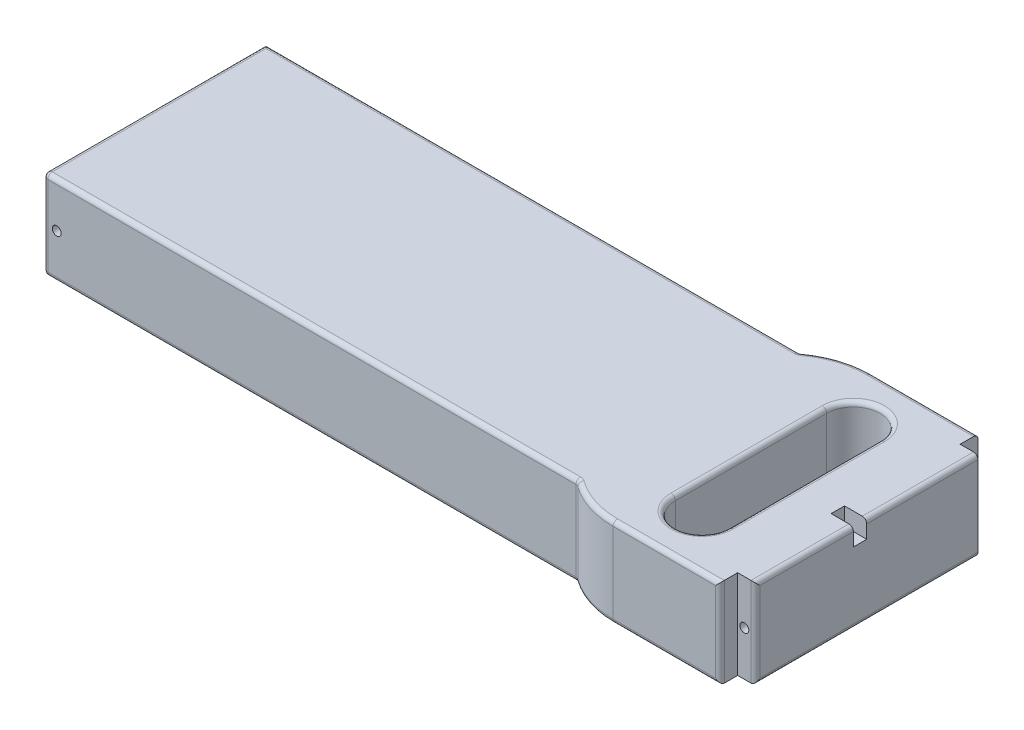
from build123d import *

# Parameters (mm, degrees)
SALIENTE_EXTRUIR1_DEPTH = 1
REDONDEO1_R             = 0.05
CORTAR_EXTRUIR1_DEPTH   = 1
REDONDEO2_R             = 0.05
CROQUIS3_R              = 0.05
CORTAR_EXTRUIR2_DEPTH   = 9.502352647
CORTAR_EXTRUIR3_DEPTH   = 0.2


with BuildPart() as part:
    # Croquis1 → Saliente-Extruir1 (new body)
    with BuildSketch(Plane(origin=(0, 0, 0), x_dir=(1, 0, 0), z_dir=(0, 1, 0))):
        with BuildLine():
            Line((0, 0), (0, 1.328125))
            Line((0, 1.328125), (6, 1.328125))
            ThreePointArc((6, 1.328125), (6.283772234, 1.476808298), (6.6, 1.528125))
            Line((6.6, 1.528125), (7.8, 1.528125))
            Line((7.8, 1.528125), (7.8, 1.328125))
            Line((7.8, 1.328125), (8, 1.328125))
            Line((8, 1.328125), (8, -1.171875))
            Line((8, -1.171875), (7.8, -1.171875))
            Line((7.8, -1.171875), (7.8, -1.371875))
            Line((7.8, -1.371875), (6.6, -1.371875))
            ThreePointArc((6.6, -1.371875), (6.283772234, -1.320558298), (6, -1.171875))
            Line((6, -1.171875), (0, -1.171875))
            Line((0, -1.171875), (0, 0))
        make_face()
    extrude(amount=SALIENTE_EXTRUIR1_DEPTH)

    # Redondeo1
    redondeo1_edges = [part.edges().sort_by_distance(p)[0] for p in [
        (8, 0, -0.078125),
        (6.283772234, 0, -1.476808298),
        (3, 0, -1.328125),
        (0, 0, -0.078125),
        (6.283772234, 0, 1.320558298),
        (0, 0.5, 1.171875),
        (6, 0.5, 1.171875),
        (3, 0, 1.171875),
        (3, 1, -1.328125),
        (6.283772234, 1, -1.476808298),
        (8, 1, -0.078125),
        (6.283772234, 1, 1.320558298),
        (3, 1, 1.171875),
        (0, 1, -0.078125),
        (7.2, 0, 1.371875),
        (7.2, 0, -1.528125),
        (7.2, 1, -1.528125),
        (7.2, 1, 1.371875),
        (7.8, 0.5, 1.371875),
        (8, 0.5, 1.171875),
        (6, 0.5, -1.328125),
    ]]
    fillet(redondeo1_edges, radius=REDONDEO1_R)

    # Croquis2 → Cortar-Extruir1 (cut)
    with BuildSketch(Plane(origin=(0, 1, 0), x_dir=(1, 0, 0), z_dir=(0, 1, 0))):
        with BuildLine():
            Line((7.3, -0.771875), (7.3, 0.928125))
            ThreePointArc((7.3, 0.928125), (7, 1.228125), (6.7, 0.928125))
            Line((6.7, 0.928125), (6.7, -0.771875))
            ThreePointArc((6.7, -0.771875), (7, -1.071875), (7.3, -0.771875))
        make_face()
    extrude(amount=-CORTAR_EXTRUIR1_DEPTH, mode=Mode.SUBTRACT)

    # Redondeo2
    redondeo2_edges = [part.edges().sort_by_distance(p)[0] for p in [
        (7, 0, -1.228125),
        (7.3, 0, -0.078125),
        (7, 0, 1.071875),
        (6.7, 0, -0.078125),
        (7, 1, -1.228125),
        (6.7, 1, -0.078125),
        (7, 1, 1.071875),
        (7.3, 1, -0.078125),
    ]]
    fillet(redondeo2_edges, radius=REDONDEO2_R)

    # Croquis3 → Cortar-Extruir2 (cut, through all)
    with BuildSketch(Plane.XY.offset(1.171875)):
        with Locations((7.875, 0.500489471)):
            Circle(CROQUIS3_R)
        with Locations((0.15, 0.500489471)):
            Circle(CROQUIS3_R)
    extrude(amount=-CORTAR_EXTRUIR2_DEPTH, mode=Mode.SUBTRACT)

    # Croquis4 → Cortar-Extruir3 (cut)
    with BuildSketch(Plane(origin=(0, 1, 0), x_dir=(1, 0, 0), z_dir=(0, 1, 0))):
        Polygon((7.95, -0.071875), (7.75, -0.071875), (7.75, 0.078125), (7.95, 0.078125), (8.181877464, 0.078125), (8.181877464, -0.071875), align=None)
    extrude(amount=-CORTAR_EXTRUIR3_DEPTH, mode=Mode.SUBTRACT)


solid = part.part
